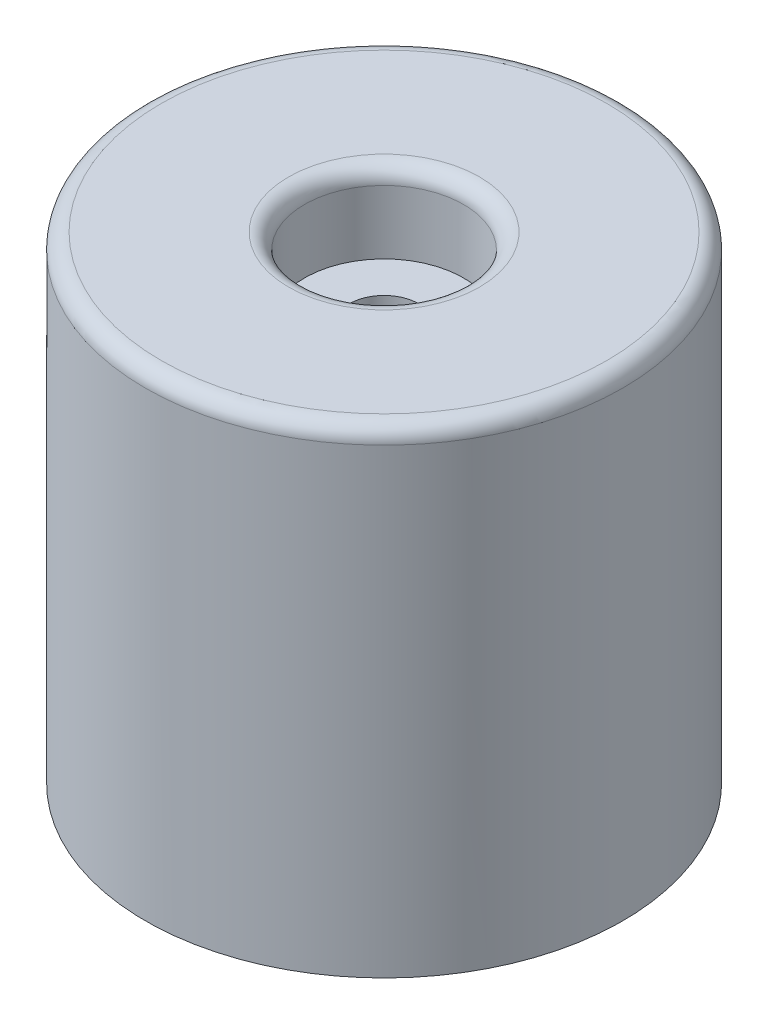
from build123d import *

# Parameters (mm, degrees)
SKETCH1_R           = 19.05
BOSS_EXTRUDE1_DEPTH = 38.1
SKETCH2_R           = 6.35
CUT_EXTRUDE1_DEPTH  = 6.35
SKETCH3_R           = 2.778125
CUT_EXTRUDE2_DEPTH  = 42.639734629
FILLET1_R           = 1.27


with BuildPart() as part:
    # Sketch1 → Boss-Extrude1 (new body)
    with BuildSketch(Plane(origin=(0, 0, 0), x_dir=(1, 0, 0), z_dir=(0, 1, 0))):
        with Locations(Location((0, 0, 0), (0, 0, 90))):
            Circle(SKETCH1_R)
    extrude(amount=BOSS_EXTRUDE1_DEPTH)

    # Sketch2 → Cut-Extrude1 (cut)
    with BuildSketch(Plane(origin=(0, 38.1, 0), x_dir=(1, 0, 0), z_dir=(0, 1, 0))):
        with Locations(Location((0, 0, 0), (0, 0, 270))):
            Circle(SKETCH2_R)
    extrude(amount=-CUT_EXTRUDE1_DEPTH, mode=Mode.SUBTRACT)

    # Sketch3 → Cut-Extrude2 (cut, through all)
    with BuildSketch(Plane(origin=(0, 31.75, 0), x_dir=(1, 0, 0), z_dir=(0, 1, 0))):
        with Locations(Location((0, 0, 0), (0, 0, 270))):
            Circle(SKETCH3_R)
    extrude(amount=-CUT_EXTRUDE2_DEPTH, mode=Mode.SUBTRACT)

    # Fillet1
    fillet1_edges = [part.edges().sort_by_distance(p)[0] for p in [
        (0, 38.1, 19.05),
        (0, 38.1, -6.35),
    ]]
    fillet(fillet1_edges, radius=FILLET1_R)


solid = part.part
